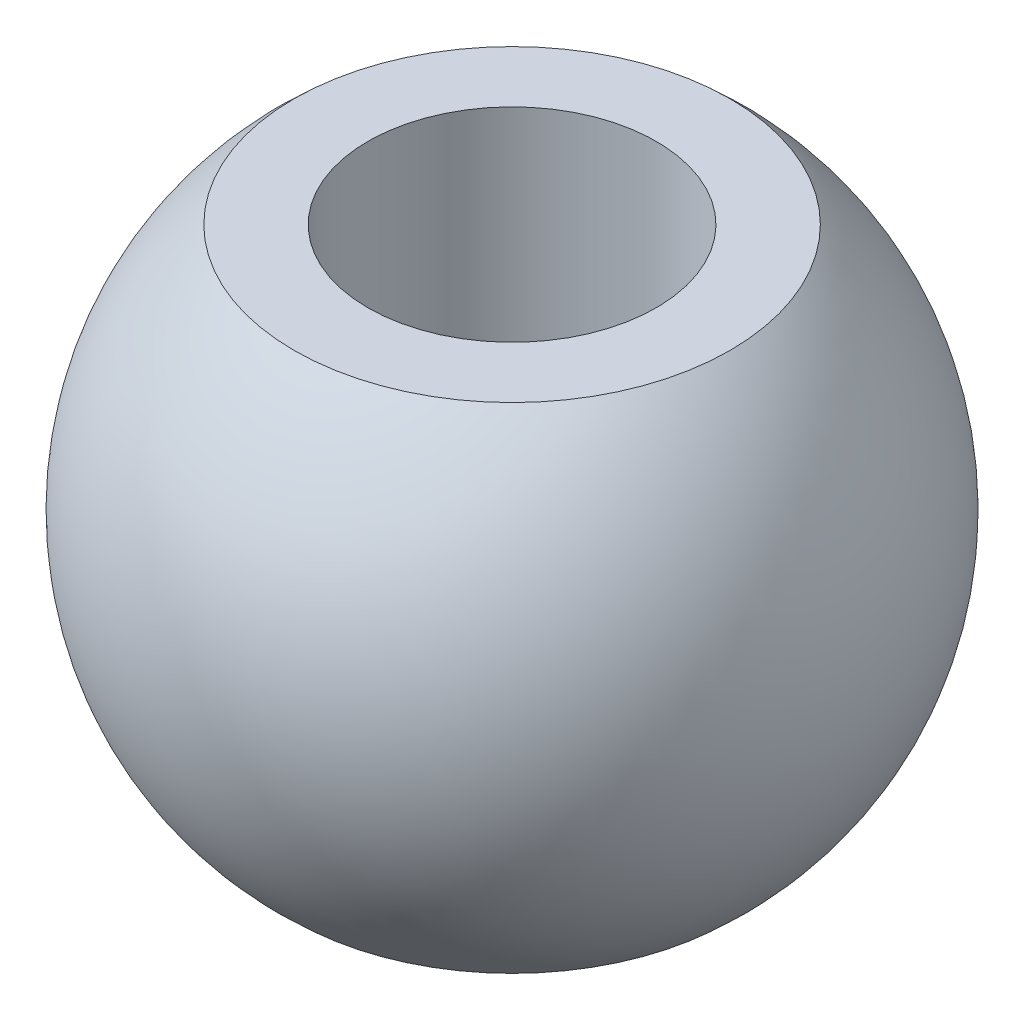
from build123d import *


with BuildPart() as part:
    # Esquisse1 → Révolution1 (revolve)
    with BuildSketch(Plane.XY):
        with BuildLine():
            Line((-1.75, 3), (-1.75, -3))
            Line((-1.75, -3), (-2.645751311, -3))
            ThreePointArc((-2.645751311, -3), (-4, 0), (-2.645751311, 3))
            Line((-2.645751311, 3), (-1.75, 3))
        make_face()
    revolve(axis=Axis((0, 3.894268411, 0), (0, -1, 0)))


solid = part.part
